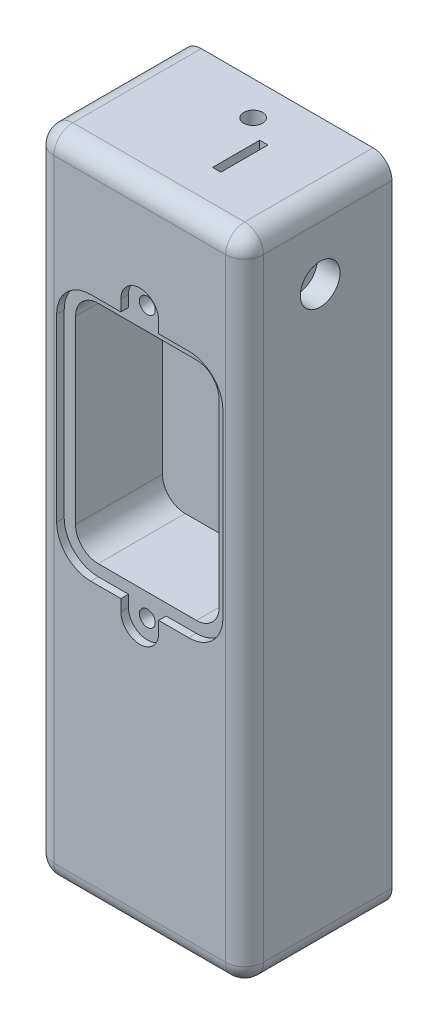
from build123d import *

# Parameters (mm, degrees)
ESQUISSE1_R              = 4.000000000000002
ESQUISSE1_R_2            = 1.600000000000006
BOSS_EXTRU_1_DEPTH       = 25
ESQUISSE1_R_3            = 4
BOSS_EXTRU_1_2_DEPTH     = 25
ESQUISSE1_R_4            = 4.000000000000001
ESQUISSE1_R_5            = 1.6000000000000019
BOSS_EXTRU_1_3_DEPTH     = 25
BOSS_EXTRU_1_4_DEPTH     = 25
BOSS_EXTRU_1_5_DEPTH     = 25
BOSS_EXTRU_2_DEPTH       = 5
CONG_1_R                 = 5
BOSS_EXTRU_3_DEPTH       = 34
ENL_V_MAT_EXTRU_1_REACH  = 178.971
ESQUISSE5_R              = 2.4999999999999987
CONG_2_R                 = 5
BOSS_EXTRU_9_DEPTH       = 30
ESQUISSE9_R              = 2.4999999999999987
ENL_V_MAT_EXTRU_3_DEPTH  = 22
ESQUISSE13_R             = 2.500000000000001
ENL_V_MAT_EXTRU_4_DEPTH  = 31
ESQUISSE14_R             = 5.250000000000006
ENL_V_MAT_EXTRU_5_DEPTH  = 6
ENL_V_MAT_EXTRU_6_DEPTH  = 5
CONG_3_R                 = 6
ENL_V_MAT_EXTRU_7_DEPTH  = 2
ENL_V_MAT_EXTRU_8_DEPTH  = 2
ESQUISSE21_R             = 4.500000000000001
ESQUISSE21_R_2           = 4.5
BOSS_EXTRU_13_DEPTH      = 10
ESQUISSE22_R             = 2.1000000000000068
ESQUISSE22_R_2           = 2.1
ENL_V_MAT_EXTRU_9_DEPTH  = 8
ENL_V_MAT_EXTRU_10_REACH = 178.971
CONG_4_R                 = 1.5
ENL_V_MAT_EXTRU_11_REACH = 178.971
ENL_V_MAT_EXTRU_12_DEPTH = 1.8
BOSS_EXTRU_19_START      = 20
BOSS_EXTRU_19_DEPTH      = 20
BOSS_EXTRU_20_START      = 2
BOSS_EXTRU_20_DEPTH      = 2
ENL_V_MAT_EXTRU_13_REACH = 106.969
ESQUISSE29_R             = 1.9999999999999996
ENL_V_MAT_EXTRU_14_REACH = 178.971
ENL_V_MAT_EXTRU_15_DEPTH = 1.5


with BuildPart() as part:
    # Esquisse1 → Boss.-Extru.1 (new body)
    with BuildSketch(Plane.XY):
        with Locations((-18.880000000000003, 68.04)):
            Circle(ESQUISSE1_R)
        with Locations((-18.880000000000003, 68.04)):
            Circle(ESQUISSE1_R_2, mode=Mode.SUBTRACT)
    extrude(amount=BOSS_EXTRU_1_DEPTH)



with BuildPart() as body_2:
    # Esquisse1 → Boss.-Extru.1 2 (new body)
    with BuildSketch(Plane.XY):
        with Locations((17.62, 68.04)):
            Circle(ESQUISSE1_R_3)
        with Locations((17.62, 68.04)):
            Circle(ESQUISSE1_R_2, mode=Mode.SUBTRACT)
    extrude(amount=BOSS_EXTRU_1_2_DEPTH)


with BuildPart() as body_3:
    # Esquisse1 → Boss.-Extru.1 3 (new body)
    with BuildSketch(Plane.XY):
        with Locations((-11.6, -21.435)):
            Circle(ESQUISSE1_R_4)
        with Locations((-11.6, -21.435)):
            Circle(ESQUISSE1_R_5, mode=Mode.SUBTRACT)
    extrude(amount=BOSS_EXTRU_1_3_DEPTH)


with BuildPart() as body_4:
    # Esquisse1 → Boss.-Extru.1 4 (new body)
    with BuildSketch(Plane.XY):
        with Locations((-19.02, -68.37)):
            Circle(ESQUISSE1_R)
        with Locations((-19.02, -68.37)):
            Circle(ESQUISSE1_R_2, mode=Mode.SUBTRACT)
    extrude(amount=BOSS_EXTRU_1_4_DEPTH)


with BuildPart() as body_5:
    # Esquisse1 → Boss.-Extru.1 5 (new body)
    with BuildSketch(Plane.XY):
        with Locations((18.73, -67.83)):
            Circle(ESQUISSE1_R_3)
        with Locations((18.73, -67.83)):
            Circle(ESQUISSE1_R_2, mode=Mode.SUBTRACT)
    extrude(amount=BOSS_EXTRU_1_5_DEPTH)


with BuildPart() as part_1:
    add(part.part)

    add(body_2.part)  # Boss.-Extru.2 merges body 2

    add(body_3.part)  # Boss.-Extru.2 merges body 3

    add(body_4.part)  # Boss.-Extru.2 merges body 4

    add(body_5.part)  # Boss.-Extru.2 merges body 5
    # Esquisse2 → Boss.-Extru.2 (add)
    with BuildSketch(Plane.XY.offset(25)):
        Polygon((-27.740000000000002, 98.04), (27.740000000000002, 98.04), (27.740000000000023, -74.15), (-27.73999999999998, -74.15), align=None)
    extrude(amount=BOSS_EXTRU_2_DEPTH)

    # Congé1
    cong_1_edges = [part_1.edges().sort_by_distance(p)[0] for p in [
        (-27.73999999999998, -74.15, 27.5),
        (27.740000000000023, -74.15, 27.5),
        (27.740000000000002, 98.04, 27.5),
        (-27.740000000000002, 98.04, 27.5),
    ]]
    fillet(cong_1_edges, radius=CONG_1_R)

    # Esquisse4 → Boss.-Extru.3 (add)
    with BuildSketch(Plane(origin=(0, 0, 25), x_dir=(-1, 0, 0), z_dir=(0, 0, -1))):
        with BuildLine():
            Line((27.73999999999998, -69.14999999999995), (27.740000000000002, 93.03999999999999))
            ThreePointArc((27.740000000000002, 93.03999999999999), (26.27553390593274, 96.57553390593273), (22.74, 98.04))
            Line((22.74, 98.04), (-22.739999999999995, 98.04))
            ThreePointArc((-22.739999999999995, 98.04), (-26.275533905932743, 96.57553390593274), (-27.740000000000002, 93.03999999999999))
            Line((-27.740000000000002, 93.03999999999999), (-27.740000000000023, -69.14999999999995))
            ThreePointArc((-27.740000000000023, -69.14999999999995), (-26.27553390593278, -72.68553390593273), (-22.740000000000016, -74.15))
            Line((-22.740000000000016, -74.15), (22.73999999999998, -74.15))
            ThreePointArc((22.73999999999998, -74.15), (26.27553390593274, -72.68553390593273), (27.73999999999998, -69.14999999999995))
        make_face()
        with BuildLine():
            Line((24.73999999999998, -69.14999999999999), (24.73999999999998, 93.04))
            ThreePointArc((24.73999999999998, 93.04), (24.154213562373076, 94.45421356237308), (22.74, 95.04))
            Line((22.74, 95.04), (-22.73999999999999, 95.03999999999999))
            ThreePointArc((-22.73999999999999, 95.03999999999999), (-24.154213562373087, 94.45421356237308), (-24.740000000000002, 93.03999999999999))
            Line((-24.740000000000002, 93.03999999999999), (-24.740000000000002, -69.14999999999999))
            ThreePointArc((-24.740000000000002, -69.14999999999999), (-24.1542135623731, -70.56421356237307), (-22.74000000000002, -71.15))
            Line((-22.74000000000002, -71.15), (22.739999999999977, -71.15))
            ThreePointArc((22.739999999999977, -71.15), (24.15421356237308, -70.5642135623731), (24.73999999999998, -69.14999999999999))
        make_face(mode=Mode.SUBTRACT)
    extrude(amount=BOSS_EXTRU_3_DEPTH)

    # Esquisse5 → Enlèv. mat.-Extru.1 (cut, up to next)
    with BuildSketch(Plane(origin=(0, 98.04, 0), x_dir=(1, 0, 0), z_dir=(0, 1, 0)), mode=Mode.PRIVATE) as enl_v_mat_extru_1_sk1:
        with Locations(Location((0, 0, 0), (0, 0, 270))):
            Circle(ESQUISSE5_R)
    enl_v_mat_extru_1_tool1 = extrude(enl_v_mat_extru_1_sk1.sketch, amount=-ENL_V_MAT_EXTRU_1_REACH, mode=Mode.PRIVATE) & part_1.part
    add(enl_v_mat_extru_1_tool1.solids().sort_by_distance((0, 98.04, 0))[0], mode=Mode.SUBTRACT)

    # Congé2
    cong_2_edges = [part_1.edges().sort_by_distance(p)[0] for p in [
        (-27.73999999999999, 11.944999999999993, 30),
        (0, 98.04, 30),
        (2.132e-14, -74.15, 30),
        (27.740000000000013, 11.945000000000007, 30),
        (26.27553390593274, 96.57553390593274, 30),
        (-26.27553390593272, -72.68553390593274, 30),
        (26.27553390593276, -72.68553390593274, 30),
        (-26.27553390593274, 96.57553390593273, 30),
    ]]
    fillet(cong_2_edges, radius=CONG_2_R)

    # Esquisse8 → Boss.-Extru.9 (add)
    with BuildSketch(Plane(origin=(0, 0, 25), x_dir=(-1, 0, 0), z_dir=(0, 0, -1))):
        with BuildLine():
            Line((3.2599999999999816, 95.03999999999999), (-22.73999999999999, 95.03999999999999))
            ThreePointArc((-22.73999999999999, 95.03999999999999), (-24.154213562373087, 94.45421356237308), (-24.73999999999999, 93.03999999999999))
            Line((-24.73999999999999, 93.03999999999999), (-24.73999999999999, 73.03999999999996))
            Line((-24.73999999999999, 73.03999999999996), (3.2599999999999807, 73.03999999999996))
            Line((3.2599999999999807, 73.03999999999996), (3.2599999999999816, 95.03999999999999))
        make_face()
    extrude(amount=BOSS_EXTRU_9_DEPTH)

    # Esquisse9 → Enlèv. mat.-Extru.3 (cut)
    with BuildSketch(Plane(origin=(0, 95.03999999999999, 0), x_dir=(1, 0, 0), z_dir=(0, 1, 0))):
        with Locations(Location((0, 0, 0), (0, 0, 270))):
            Circle(ESQUISSE9_R)
    extrude(amount=-ENL_V_MAT_EXTRU_3_DEPTH, mode=Mode.SUBTRACT)

    # Esquisse13 → Enlèv. mat.-Extru.4 (cut)
    with BuildSketch(Plane.ZY.offset(3.2599999999999776)):
        with Locations(Location((9.999999999999998, 78.77246810437555, 0), (0, 0, 270))):
            Circle(ESQUISSE13_R)
    extrude(amount=-ENL_V_MAT_EXTRU_4_DEPTH, mode=Mode.SUBTRACT)

    # Esquisse14 → Enlèv. mat.-Extru.5 (cut)
    with BuildSketch(Plane(origin=(27.740000000000013, 3.35e-15, 0), x_dir=(0, 0, -1), z_dir=(1, 1.2e-16, 0))):
        with Locations(Location((-9.999999999999998, 78.77246810437555, 0), (0, 0, 90))):
            Circle(ESQUISSE14_R)
    extrude(amount=-ENL_V_MAT_EXTRU_5_DEPTH, mode=Mode.SUBTRACT)

    # Esquisse16 → Enlèv. mat.-Extru.6 (cut)
    with BuildSketch(Plane.XY.offset(30.000000000000004)):
        Polygon((18.999999999999996, 3.3499999999999917), (-19.000000000000004, 3.349999999999987), (-19.000000000000004, 63.039999999999985), (18.999999999999996, 63.039999999999985), align=None)
    extrude(amount=-ENL_V_MAT_EXTRU_6_DEPTH, mode=Mode.SUBTRACT)

    # Congé3
    cong_3_edges = [part_1.edges().sort_by_distance(p)[0] for p in [
        (-19.000000000000004, 3.349999999999987, 27.500000000000004),
        (-19.000000000000004, 63.039999999999985, 27.500000000000004),
        (18.999999999999996, 63.039999999999985, 27.500000000000004),
        (18.999999999999996, 3.3499999999999917, 27.500000000000004),
    ]]
    fillet(cong_3_edges, radius=CONG_3_R)

    # Esquisse18 → Enlèv. mat.-Extru.7 (cut)
    with BuildSketch(Plane.XY.offset(30.000000000000004)):
        with BuildLine():
            Line((21.999999999999996, 9.34999999999999), (21.999999999999996, 57.039999999999985))
            ThreePointArc((21.999999999999996, 57.039999999999985), (19.363961030678926, 63.403961030678914), (12.999999999999996, 66.03999999999999))
            Line((12.999999999999996, 66.03999999999999), (-13.000000000000007, 66.03999999999999))
            ThreePointArc((-13.000000000000007, 66.03999999999999), (-19.363961030678947, 63.40396103067891), (-22.000000000000004, 57.03999999999996))
            Line((-22.000000000000004, 57.03999999999996), (-22.000000000000004, 9.34999999999999))
            ThreePointArc((-22.000000000000004, 9.34999999999999), (-19.363961030678933, 2.986038969321063), (-13.000000000000004, 0.3499999999999892))
            Line((-13.000000000000004, 0.3499999999999892), (12.999999999999998, 0.34999999999999093))
            ThreePointArc((12.999999999999998, 0.34999999999999093), (19.363961030678926, 2.986038969321063), (21.999999999999996, 9.34999999999999))
        make_face()
    extrude(amount=-ENL_V_MAT_EXTRU_7_DEPTH, mode=Mode.SUBTRACT)

    # Esquisse20 → Enlèv. mat.-Extru.8 (cut)
    with BuildSketch(Plane.XY.offset(28.000000000000004)):
        with BuildLine():
            Line((5, 69.03999999999999), (5.000000000000001, 63.039999999999985))
            ThreePointArc((5.000000000000001, 63.039999999999985), (1.8e-16, 58.039999999999985), (-4.999999999999999, 63.039999999999985))
            Line((-4.999999999999999, 63.039999999999985), (-5, 69.03999999999999))
            ThreePointArc((-5, 69.03999999999999), (3.1e-16, 74.03999999999999), (5, 69.03999999999999))
        make_face()
        with BuildLine():
            Line((5.000000000000011, 3.3499999999999908), (5.000000000000011, -2.650000000000009))
            ThreePointArc((5.000000000000011, -2.650000000000009), (8.93e-15, -7.650000000000012), (-4.999999999999993, -2.6500000000000075))
            Line((-4.999999999999993, -2.6500000000000075), (-4.999999999999993, 3.3499999999999894))
            ThreePointArc((-4.999999999999993, 3.3499999999999894), (9.04e-15, 8.349999999999993), (5.000000000000011, 3.3499999999999908))
        make_face()
    extrude(amount=ENL_V_MAT_EXTRU_8_DEPTH, mode=Mode.SUBTRACT)

    # Esquisse21 → Boss.-Extru.13 (add)
    with BuildSketch(Plane(origin=(0, 0, 25), x_dir=(-1, 0, 0), z_dir=(0, 0, -1))):
        with Locations((0, 69.03999999999999)):
            Circle(ESQUISSE21_R)
        with Locations(Location((-9.85e-15, -2.6500000000000092, 0), (0, 0, 180))):
            Circle(ESQUISSE21_R_2)
    extrude(amount=BOSS_EXTRU_13_DEPTH)

    # Esquisse22 → Enlèv. mat.-Extru.9 (cut)
    with BuildSketch(Plane.XY.offset(28.000000000000004)):
        with Locations((0, 69.03999999999999)):
            Circle(ESQUISSE22_R)
        with Locations((9.85e-15, -2.6500000000000092)):
            Circle(ESQUISSE22_R_2)
    extrude(amount=-ENL_V_MAT_EXTRU_9_DEPTH, mode=Mode.SUBTRACT)

    # Esquisse23 → Enlèv. mat.-Extru.10 (cut, up to next)
    with BuildSketch(Plane.XZ.offset(74.15), mode=Mode.PRIVATE) as enl_v_mat_extru_10_sk1:
        Polygon((4.001999999999999, 3.6500000000000075), (-5.018961215509872, 3.649999999999995), (-4.697999999999998, 8.349999999999994), (4.322961215509869, 8.35000000000001), align=None)
    enl_v_mat_extru_10_tool1 = extrude(enl_v_mat_extru_10_sk1.sketch, amount=-ENL_V_MAT_EXTRU_10_REACH, mode=Mode.PRIVATE) & part_1.part
    add(enl_v_mat_extru_10_tool1.solids().sort_by_distance((-0.348, -74.15, 6))[0], mode=Mode.SUBTRACT)

    # Congé4
    cong_4_edges = [part_1.edges().sort_by_distance(p)[0] for p in [
        (4.322961215509869, -72.65, 8.35000000000001),
        (-5.018961215509872, -72.65, 3.649999999999995),
        (4.001999999999999, -72.65, 3.6500000000000075),
        (-4.697999999999998, -72.65, 8.349999999999994),
    ]]
    fillet(cong_4_edges, radius=CONG_4_R)

    # Esquisse24 → Enlèv. mat.-Extru.11 (cut, up to next)
    with BuildSketch(Plane.XZ.offset(74.15), mode=Mode.PRIVATE) as enl_v_mat_extru_11_sk1:
        Polygon((6.700000000000026, 21.35), (-6.699999999999974, 21.35), (-6.6999999999999735, 12.650000000000002), (6.700000000000027, 12.650000000000004), align=None)
    enl_v_mat_extru_11_tool1 = extrude(enl_v_mat_extru_11_sk1.sketch, amount=-ENL_V_MAT_EXTRU_11_REACH, mode=Mode.PRIVATE) & part_1.part
    add(enl_v_mat_extru_11_tool1.solids().sort_by_distance((0, -74.15, 17))[0], mode=Mode.SUBTRACT)

    # Esquisse26 → Enlèv. mat.-Extru.12 (cut)
    with BuildSketch(Plane.XZ.offset(74.15)):
        Polygon((7.500000000000025, 11.800000000000002), (-7.499999999999974, 11.8), (-7.499999999999974, 22.2), (7.500000000000025, 22.2), align=None)
    extrude(amount=-ENL_V_MAT_EXTRU_12_DEPTH, mode=Mode.SUBTRACT)

    # Esquisse27 → Boss.-Extru.19 (add)
    with BuildSketch(Plane(origin=(0, 0, 25), x_dir=(-1, 0, 0), z_dir=(0, 0, -1)).offset(BOSS_EXTRU_19_START)):
        with BuildLine():
            Line((-12.999999999999996, 1.349999999999991), (13.000000000000007, 1.349999999999991))
            ThreePointArc((13.000000000000007, 1.349999999999991), (18.656854249492383, 3.69314575050761), (21.000000000000004, 9.349999999999987))
            Line((21.000000000000004, 9.349999999999987), (21.000000000000004, 57.039999999999985))
            ThreePointArc((21.000000000000004, 57.039999999999985), (18.656854249492383, 62.69685424949236), (13.000000000000005, 65.03999999999999))
            Line((13.000000000000005, 65.03999999999999), (-12.999999999999998, 65.03999999999999))
            ThreePointArc((-12.999999999999998, 65.03999999999999), (-18.656854249492383, 62.69685424949237), (-20.999999999999996, 57.039999999999985))
            Line((-20.999999999999996, 57.039999999999985), (-20.999999999999996, 9.34999999999999))
            ThreePointArc((-20.999999999999996, 9.34999999999999), (-18.656854249492376, 3.693145750507611), (-12.999999999999996, 1.349999999999991))
        make_face()
        with BuildLine():
            Line((-12.999999999999996, 3.349999999999991), (13.000000000000005, 3.3499999999999885))
            ThreePointArc((13.000000000000005, 3.3499999999999885), (17.24264068711929, 5.107359312880704), (19.000000000000004, 9.349999999999989))
            Line((19.000000000000004, 9.349999999999989), (19.000000000000004, 57.039999999999985))
            ThreePointArc((19.000000000000004, 57.039999999999985), (17.24264068711929, 61.28264068711927), (13.000000000000005, 63.039999999999985))
            Line((13.000000000000005, 63.039999999999985), (-12.999999999999996, 63.039999999999985))
            ThreePointArc((-12.999999999999996, 63.039999999999985), (-17.24264068711928, 61.28264068711927), (-18.999999999999996, 57.039999999999985))
            Line((-18.999999999999996, 57.039999999999985), (-18.999999999999996, 9.34999999999999))
            ThreePointArc((-18.999999999999996, 9.34999999999999), (-17.242640687119284, 5.107359312880706), (-12.999999999999996, 3.349999999999991))
        make_face(mode=Mode.SUBTRACT)
    extrude(amount=-BOSS_EXTRU_19_DEPTH)

    # Esquisse28 → Boss.-Extru.20 (add)
    with BuildSketch(Plane(origin=(0, 0, 5.000000000000001), x_dir=(-1, 0, 0), z_dir=(0, 0, -1)).offset(BOSS_EXTRU_20_START)):
        with BuildLine():
            Line((-20.999999999999996, 57.039999999999985), (-20.999999999999996, 9.349999999999993))
            ThreePointArc((-20.999999999999996, 9.349999999999993), (-18.656854249492376, 3.693145750507611), (-12.999999999999996, 1.349999999999991))
            Line((-12.999999999999996, 1.349999999999991), (13.000000000000004, 1.34999999999999))
            ThreePointArc((13.000000000000004, 1.34999999999999), (18.656854249492383, 3.6931457505076093), (21.000000000000004, 9.349999999999989))
            Line((21.000000000000004, 9.349999999999989), (21.000000000000004, 57.039999999999985))
            ThreePointArc((21.000000000000004, 57.039999999999985), (18.656854249492383, 62.69685424949236), (13.000000000000005, 65.03999999999999))
            Line((13.000000000000005, 65.03999999999999), (-12.999999999999998, 65.03999999999999))
            ThreePointArc((-12.999999999999998, 65.03999999999999), (-14.281617081194788, 64.93667383505166), (-15.530128017906552, 64.62936441429743))
            ThreePointArc((-15.530128017906552, 64.62936441429743), (-16.071070062579636, 64.35207157757057), (-16.64778363861102, 64.15994905360155))
            ThreePointArc((-16.64778363861102, 64.15994905360155), (-19.825769887305324, 61.212393251547105), (-20.999999999999996, 57.039999999999985))
        make_face()
    extrude(amount=-BOSS_EXTRU_20_DEPTH)

    # Esquisse29 → Enlèv. mat.-Extru.13 (cut, up to next)
    with BuildSketch(Plane.XZ.offset(-1.349999999999991), mode=Mode.PRIVATE) as enl_v_mat_extru_13_sk1:
        with Locations(Location((10.951190034816705, 14, 0), (0, 0, 270))):
            Circle(ESQUISSE29_R)
    enl_v_mat_extru_13_tool1 = extrude(enl_v_mat_extru_13_sk1.sketch, amount=-ENL_V_MAT_EXTRU_13_REACH, mode=Mode.PRIVATE) & part_1.part
    add(enl_v_mat_extru_13_tool1.solids().sort_by_distance((10.95119, 1.35, 14))[0], mode=Mode.SUBTRACT)

    # Esquisse6 → Enlèv. mat.-Extru.14 (cut, up to next)
    with BuildSketch(Plane(origin=(0, 98.04, 0), x_dir=(1, 0, 0), z_dir=(0, 1, 0)), mode=Mode.PRIVATE) as enl_v_mat_extru_14_sk1:
        Polygon((8.2, -16.75), (5.999999999999999, -16.750000000000004), (5.999999999999998, -4.250000000000002), (8.2, -4.250000000000001), align=None)
    enl_v_mat_extru_14_tool1 = extrude(enl_v_mat_extru_14_sk1.sketch, amount=-ENL_V_MAT_EXTRU_14_REACH, mode=Mode.PRIVATE) & part_1.part
    add(enl_v_mat_extru_14_tool1.solids().sort_by_distance((7.1, 98.04, 10.5))[0], mode=Mode.SUBTRACT)

    # Esquisse30 → Enlèv. mat.-Extru.15 (cut)
    with BuildSketch(Plane.XZ.offset(74.15)):
        with BuildLine():
            Line((-3.4130332491096813, 1.6499999999999966), (2.600940894563565, 1.6500000000000052))
            ThreePointArc((2.600940894563565, 1.6500000000000052), (4.990019792784585, 2.592207588940223), (6.092808251873733, 4.911541703957136))
            Line((6.092808251873733, 4.911541703957136), (6.208900606419857, 6.611541703957134))
            ThreePointArc((6.208900606419857, 6.611541703957134), (5.274825660169467, 9.239078898221033), (2.7170332491096776, 10.350000000000009))
            Line((2.7170332491096776, 10.350000000000009), (-3.2969408945635665, 10.349999999999996))
            ThreePointArc((-3.2969408945635665, 10.349999999999996), (-5.686019792784581, 9.40779241105978), (-6.788808251873732, 7.088458296042876))
            Line((-6.788808251873732, 7.088458296042876), (-6.904900606419857, 5.388458296042875))
            ThreePointArc((-6.904900606419857, 5.388458296042875), (-5.970825660169471, 2.7609211017789765), (-3.4130332491096813, 1.6499999999999966))
        make_face()
    extrude(amount=-ENL_V_MAT_EXTRU_15_DEPTH, mode=Mode.SUBTRACT)


solid = part_1.part
